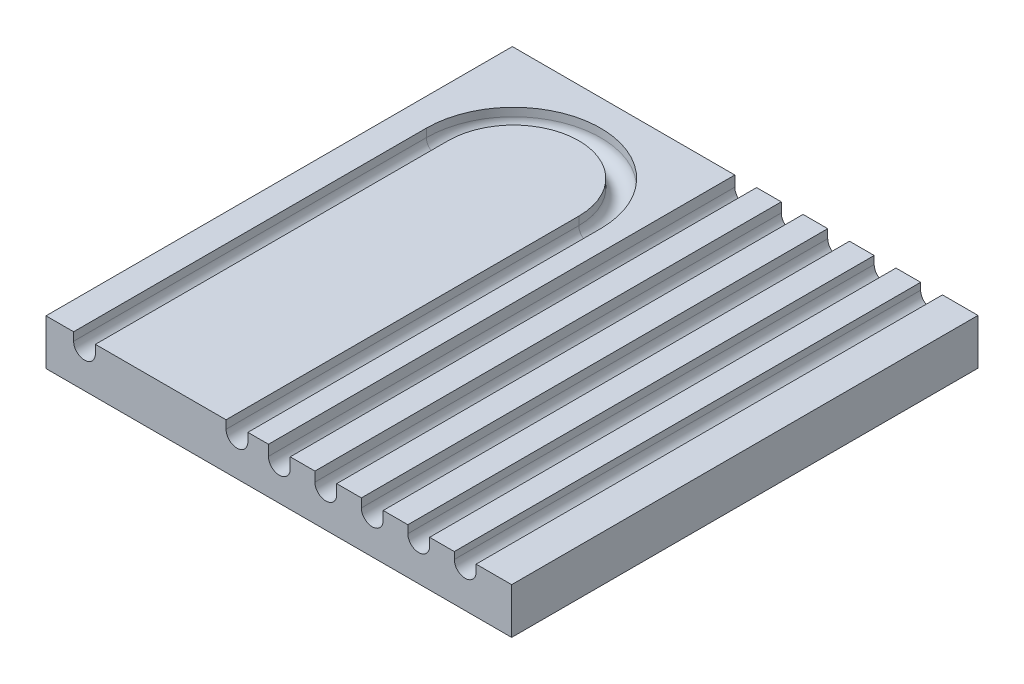
from build123d import *

# Parameters (mm, degrees)
SKETCH1_W           = 101.8286
SKETCH1_H           = 101.981
BOSS_EXTRUDE1_DEPTH = 10


with BuildPart() as part:
    # Sketch1 → Boss-Extrude1 (new body)
    with BuildSketch(Plane(origin=(0, 0, 0), x_dir=(1, 0, 0), z_dir=(0, 1, 0))):
        Rectangle(SKETCH1_W, SKETCH1_H)
    extrude(amount=BOSS_EXTRUDE1_DEPTH)

    # Cut-Sweep1: sweep along a path in Sketch2
    with BuildLine(Plane(origin=(0, 10, 0), x_dir=(1, 0, 0), z_dir=(0, 1, 0))) as cut_sweep1_path:
        Line((-42.493557128, -50.9905), (-42.493557128, 26.149650848))
        ThreePointArc((-42.493557128, 26.149650848), (-25.824807128, 42.818400848), (-9.156057128, 26.149650848))
        Line((-9.156057128, 26.149650848), (-9.156057128, -50.9905))
    # Sketch3 → Cut-Sweep1 (sweep, cut)
    with BuildSketch(Plane.XY.offset(50.9905)):
        with BuildLine():
            Line((-40.112307128, 10), (-44.874807128, 10))
            Line((-44.874807128, 10), (-44.874807128, 8.2))
            ThreePointArc((-44.874807128, 8.2), (-42.493557128, 5.81875), (-40.112307128, 8.2))
            Line((-40.112307128, 8.2), (-40.112307128, 10))
        make_face()
    sweep(path=cut_sweep1_path.line, mode=Mode.SUBTRACT)

    # Cut-Sweep2: sweep along a path in Sketch4
    with BuildLine(Plane(origin=(0, 10, 0), x_dir=(1, 0, 0), z_dir=(0, 1, 0))) as cut_sweep2_path:
        Line((10.2743, 50.9905), (10.2743, -50.9905))
    # Sketch5 → Cut-Sweep2 (sweep, cut)
    with BuildSketch(Plane.XY.offset(50.9905)):
        with BuildLine():
            Line((7.89305, 10), (12.65555, 10))
            Line((12.65555, 10), (12.65555, 7.9))
            ThreePointArc((12.65555, 7.9), (10.2743, 5.51875), (7.89305, 7.9))
            Line((7.89305, 7.9), (7.89305, 10))
        make_face()
        with BuildLine():
            Line((18.05305, 10), (22.81555, 10))
            Line((22.81555, 10), (22.81555, 8.1))
            ThreePointArc((22.81555, 8.1), (20.4343, 5.71875), (18.05305, 8.1))
            Line((18.05305, 8.1), (18.05305, 10))
        make_face()
        with BuildLine():
            Line((28.21305, 10), (32.97555, 10))
            Line((32.97555, 10), (32.97555, 8.3))
            ThreePointArc((32.97555, 8.3), (30.5943, 5.91875), (28.21305, 8.3))
            Line((28.21305, 8.3), (28.21305, 10))
        make_face()
        with BuildLine():
            Line((38.37305, 10), (43.13555, 10))
            Line((43.13555, 10), (43.13555, 8.5))
            ThreePointArc((43.13555, 8.5), (40.7543, 6.11875), (38.37305, 8.5))
            Line((38.37305, 8.5), (38.37305, 10))
        make_face()
        with BuildLine():
            Line((-2.26695, 10), (2.49555, 10))
            Line((2.49555, 10), (2.49555, 7.7))
            ThreePointArc((2.49555, 7.7), (0.1143, 5.31875), (-2.26695, 7.7))
            Line((-2.26695, 7.7), (-2.26695, 10))
        make_face()
    sweep(path=cut_sweep2_path.line, mode=Mode.SUBTRACT)


solid = part.part
